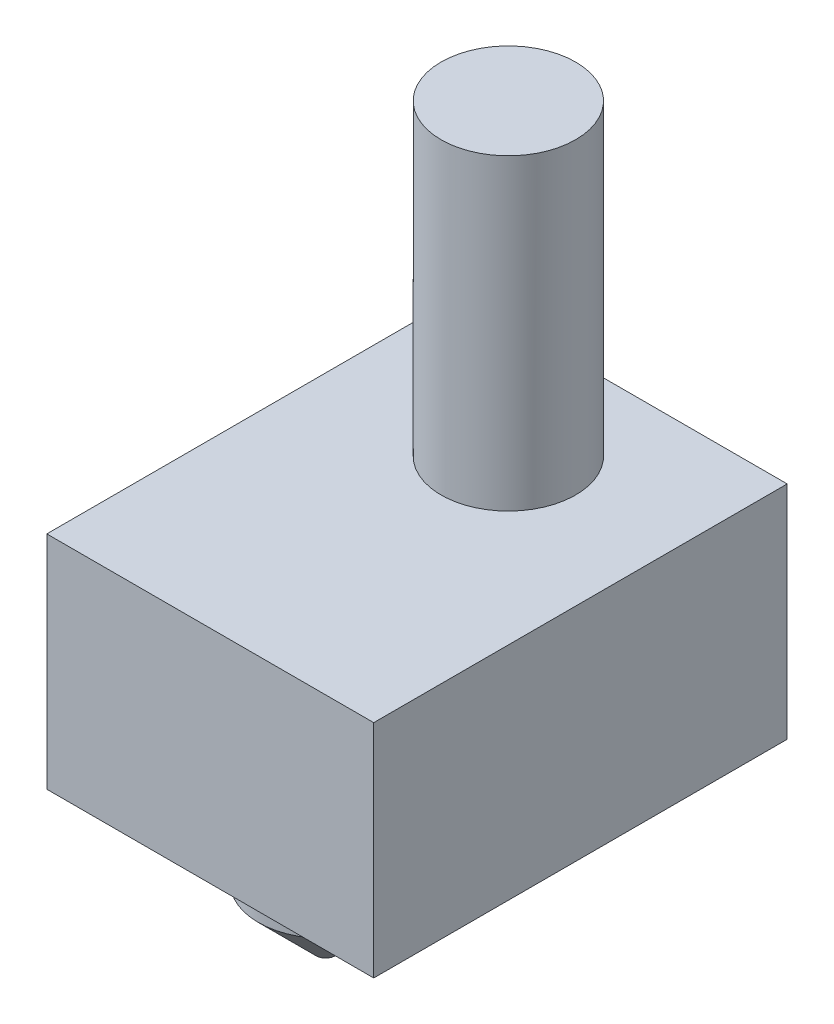
from build123d import *

# Parameters (mm, degrees)
SKETCH1_W           = 17
SKETCH1_H           = 21.5
BOSS_EXTRUDE1_DEPTH = 11.5
SKETCH2_R           = 3.5
BOSS_EXTRUDE2_DEPTH = 16
SKETCH3_R           = 3.5
BOSS_EXTRUDE3_DEPTH = 6
CHAMFER1_SIZE       = 3


with BuildPart() as part:
    # Sketch1 → Boss-Extrude1 (new body)
    with BuildSketch(Plane(origin=(0, 0, 0), x_dir=(1, 0, 0), z_dir=(0, 1, 0))):
        with Locations((8.5, 10.75)):
            Rectangle(SKETCH1_W, SKETCH1_H)
    extrude(amount=BOSS_EXTRUDE1_DEPTH)

    # Sketch2 → Boss-Extrude2 (add)
    with BuildSketch(Plane(origin=(0, 11.5, 0), x_dir=(1, 0, 0), z_dir=(0, 1, 0))):
        with Locations(Location((8.5, 15.5, 0), (0, 0, 90))):
            Circle(SKETCH2_R)
    extrude(amount=BOSS_EXTRUDE2_DEPTH)

    # Sketch3 → Boss-Extrude3 (add)
    with BuildSketch(Plane.XZ):
        with Locations(Location((8.5, -6, 0), (0, 0, 270))):
            Circle(SKETCH3_R)
    extrude(amount=BOSS_EXTRUDE3_DEPTH)

    # Chamfer1
    chamfer1_edges = [part.edges().sort_by_distance(p)[0] for p in [
        (8.5, -6, -2.5),
    ]]
    chamfer(chamfer1_edges, length=CHAMFER1_SIZE)


solid = part.part
